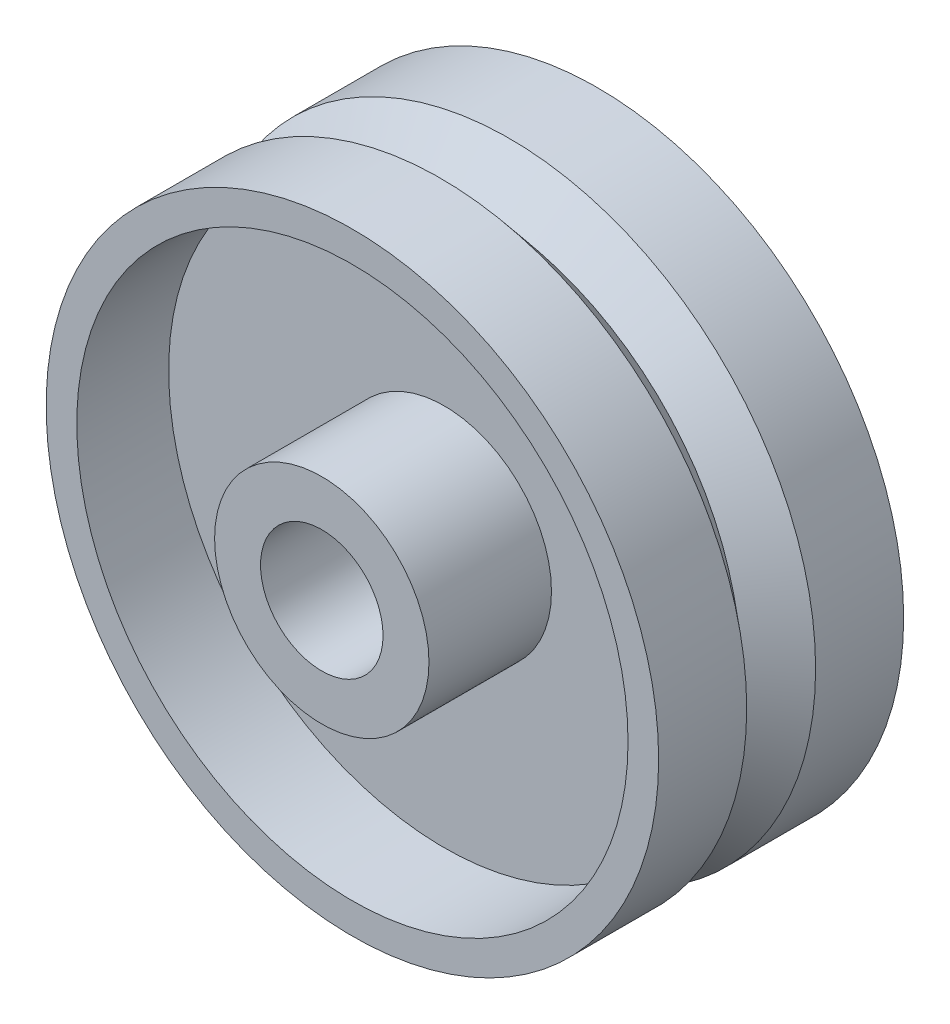
from build123d import *


with BuildPart() as part:
    # Croquis1 → Revolución1 (revolve)
    with BuildSketch(Plane(origin=(0, 0, 0), x_dir=(0, 0, -1), z_dir=(1, 0, 0)), mode=Mode.PRIVATE) as revoluci_n1_sk:
        Polygon((25, 10), (-25, 10), (-25, 17.5), (-5, 17.5), (-5, 45), (-20, 45), (-20, 50), (-5.625229638, 50), (0, 43.29611237), (5.625229638, 50), (20, 50), (20, 45), (5, 45), (5, 17.5), (25, 17.5), align=None)
    revolve(revoluci_n1_sk.sketch.rotate(Axis((0, 0, 0), (0, 0, -1)), 90), axis=Axis((0, 0, 0), (0, 0, -1)))


solid = part.part
